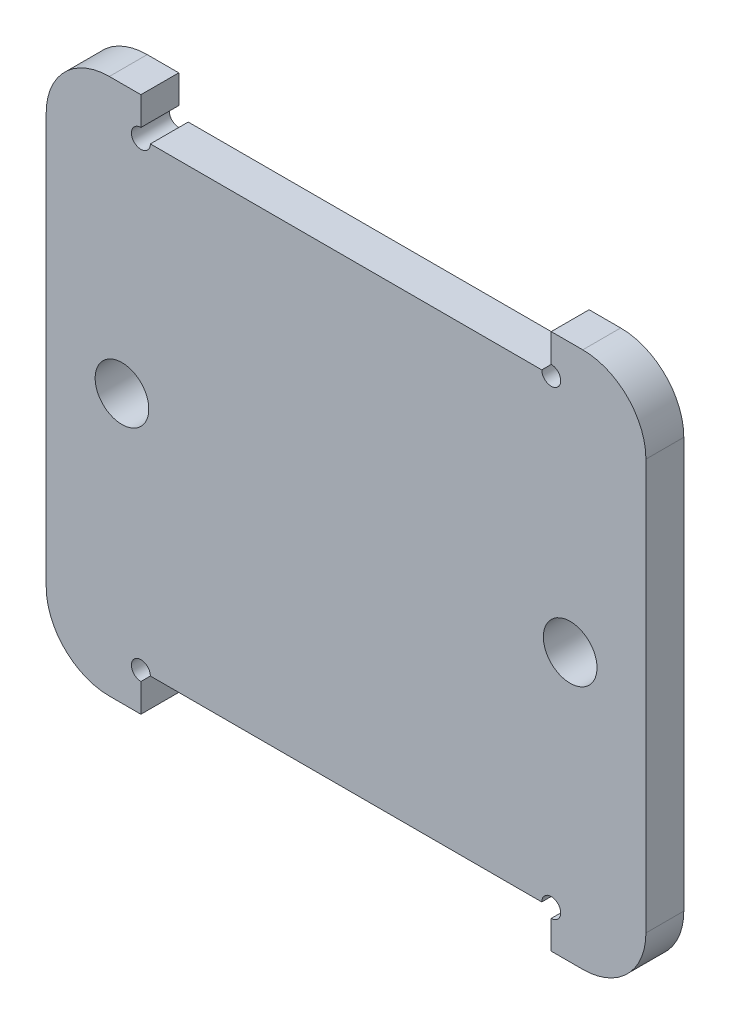
from build123d import *

# Parameters (mm, degrees)
SKETCH1_R           = 4.25
BOSS_EXTRUDE1_DEPTH = 6
SKETCH2_R           = 1.5
CUT_EXTRUDE1_DEPTH  = 413.628161909


with BuildPart() as part:
    # Sketch1 → Boss-Extrude1 (new body)
    with BuildSketch(Plane.XY):
        with BuildLine():
            Line((-384, 99), (-319, 99))
            Line((-319, 99), (-319, 105))
            Line((-319, 105), (-314, 105))
            ThreePointArc((-314, 105), (-306.928932188, 102.071067812), (-304, 95))
            Line((-304, 95), (-304, 30))
            ThreePointArc((-304, 30), (-306.928932188, 22.928932188), (-314, 20))
            Line((-314, 20), (-319, 20))
            Line((-319, 20), (-319, 26))
            Line((-319, 26), (-384, 26))
            Line((-384, 26), (-384, 20))
            Line((-384, 20), (-389, 20))
            ThreePointArc((-389, 20), (-396.071067812, 22.928932188), (-399, 30))
            Line((-399, 30), (-399, 95))
            ThreePointArc((-399, 95), (-396.071067812, 102.071067812), (-389, 105))
            Line((-389, 105), (-384, 105))
            Line((-384, 105), (-384, 99))
        make_face()
        with Locations((-316, 62.5)):
            Circle(SKETCH1_R, mode=Mode.SUBTRACT)
        with Locations(Location((-387, 62.5, 0), (0, 0, 180))):
            Circle(SKETCH1_R, mode=Mode.SUBTRACT)
    extrude(amount=BOSS_EXTRUDE1_DEPTH)

    # Sketch2 → Cut-Extrude1 (cut, through all)
    with BuildSketch(Plane.XY.offset(6)):
        with Locations((-384, 26)):
            Circle(SKETCH2_R)
        with Locations((-319, 26)):
            Circle(SKETCH2_R)
        with Locations((-384, 99)):
            Circle(SKETCH2_R)
        with Locations((-319, 99)):
            Circle(SKETCH2_R)
    extrude(amount=-CUT_EXTRUDE1_DEPTH, mode=Mode.SUBTRACT)


solid = part.part
